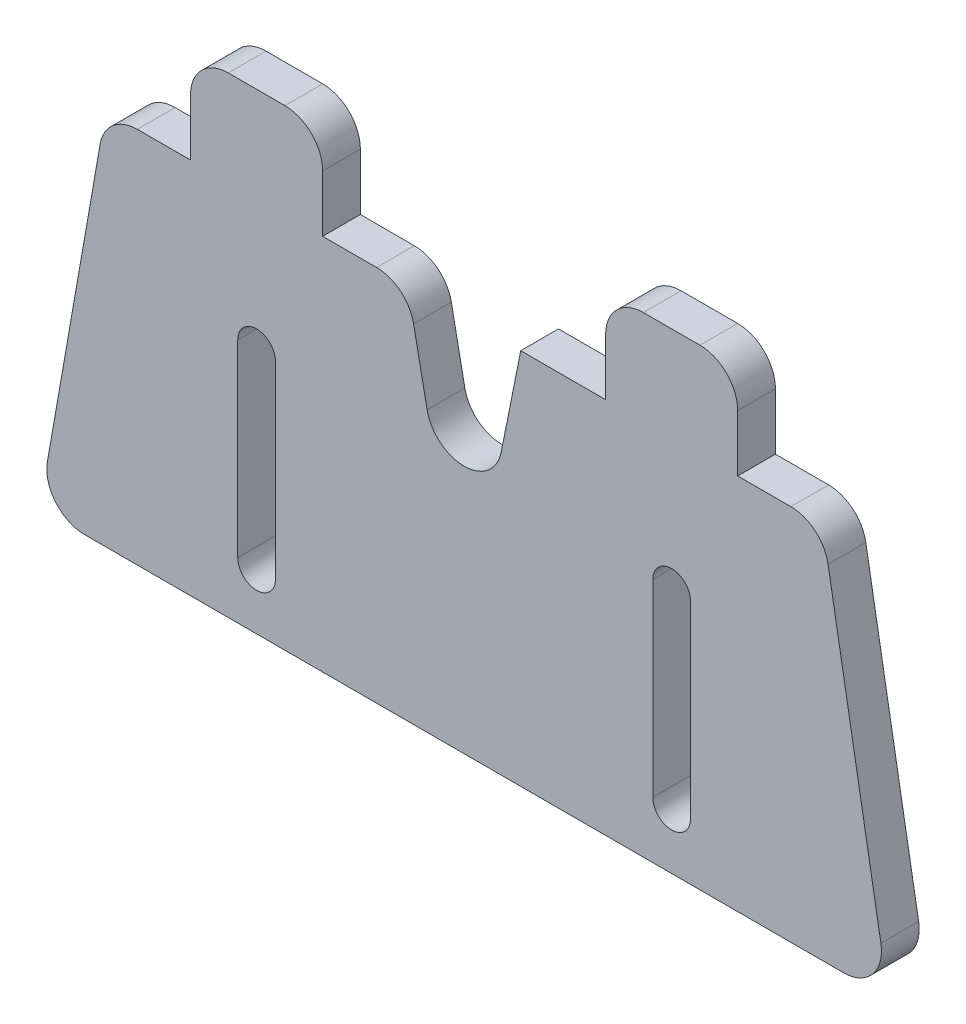
from build123d import *

# Parameters (mm, degrees)
RESSALTO_EXTRUS_O1_DEPTH = 2
FILETE1_R                = 2


with BuildPart() as part:
    # Esboço1 → Ressalto-extrusão1 (new body)
    with BuildSketch(Plane.XY):
        Polygon((-7.5, 12.5), (-14.5, 12.5), (-14.5, 7.5), (-19, 7.5), (-22.5, -12.5), (22.5, -12.5), (19, 7.5), (14.5, 7.5), (14.5, 12.5), (7.5, 12.5), (7.5, 7.5), (3, 7.5), (0, -7.5), (-3, 7.5), (-7.5, 7.5), align=None)
        with BuildLine():
            ThreePointArc((-12, 0.5), (-11, 1.5), (-10, 0.5))
            Line((-10, 0.5), (-10, -9.5))
            ThreePointArc((-10, -9.5), (-11, -10.5), (-12, -9.5))
            Line((-12, -9.5), (-12, 0.5))
        make_face(mode=Mode.SUBTRACT)
        with BuildLine():
            Line((10, -9.5), (10, 0.5))
            ThreePointArc((10, 0.5), (11, 1.5), (12, 0.5))
            Line((12, 0.5), (12, -9.5))
            ThreePointArc((12, -9.5), (11, -10.5), (10, -9.5))
        make_face(mode=Mode.SUBTRACT)
    extrude(amount=RESSALTO_EXTRUS_O1_DEPTH)

    # Filete1
    filete1_edges = [part.edges().sort_by_distance(p)[0] for p in [
        (-22.5, -12.5, 1),
        (-19, 7.5, 1),
        (-14.5, 12.5, 1),
        (-7.5, 12.5, 1),
        (-3, 7.5, 1),
        (0, -7.5, 1),
        (7.5, 12.5, 1),
        (14.5, 12.5, 1),
        (19, 7.5, 1),
        (22.5, -12.5, 1),
    ]]
    fillet(filete1_edges, radius=FILETE1_R)


solid = part.part
